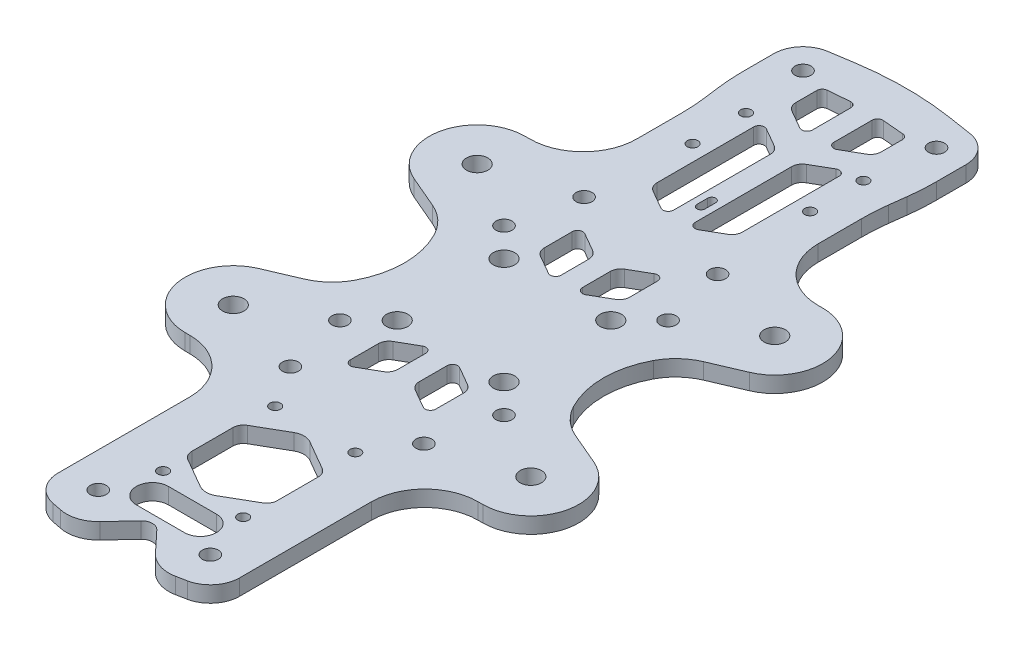
from build123d import *

# Parameters (mm, degrees)
SKETCH2_R           = 1
SKETCH2_R_2         = 1.5
SKETCH2_R_3         = 2
BOSS_EXTRUDE1_DEPTH = 3


with BuildPart() as part:
    # Sketch2 → Boss-Extrude1 (new body)
    with BuildSketch(Plane(origin=(0, 0, 0), x_dir=(1, 0, 0), z_dir=(0, 1, 0))):
        with BuildLine():
            Line((13.350883078, 73.933726478), (8.972891286, 74.619286567))
            ThreePointArc((8.972891286, 74.619286567), (-0.00011783, 75.317584084), (-8.973126945, 74.619286567))
            Line((-8.973126945, 74.619286567), (-13.350882829, 73.933763419))
            ThreePointArc((-13.350882829, 73.933763419), (-16.680339328, 72.07414751), (-17.999976849, 68.496158031))
            Line((-17.999976849, 68.496158031), (-17.99612821, 62.986537073))
            ThreePointArc((-17.99612821, 62.986537073), (-17.913159359, 60.376821385), (-17.66818978, 57.777304179))
            Line((-17.66818978, 57.777304179), (-17.287326461, 54.747455148))
            ThreePointArc((-17.287326461, 54.747455148), (-17.064020516, 52.368886066), (-16.990620696, 49.980985546))
            Line((-16.990620696, 49.980985546), (-16.994414065, 41.83534793))
            ThreePointArc((-16.994414065, 41.83534793), (-19.924991835, 34.767290769), (-26.994412981, 31.840004863))
            Line((-26.994412981, 31.840004863), (-27.864354565, 31.840004863))
            ThreePointArc((-27.864354565, 31.840004863), (-36.681216944, 24.646365231), (-31.403561403, 14.565102148))
            Line((-31.403561403, 14.565102148), (-25.40119143, 11.997866062))
            ThreePointArc((-25.40119143, 11.997866062), (-22.55844214, 10.158571988), (-20.492417257, 7.47607923))
            ThreePointArc((-20.492417257, 7.47607923), (-18.638379202, 0), (-20.492417257, -7.47607923))
            ThreePointArc((-20.492417257, -7.47607923), (-22.55844214, -10.158571988), (-25.40119143, -11.997866062))
            Line((-25.40119143, -11.997866062), (-31.403561403, -14.565102148))
            ThreePointArc((-31.403561403, -14.565102148), (-36.681216944, -24.646365231), (-27.864354565, -31.840004863))
            Line((-27.864354565, -31.840004863), (-26.999999944, -31.840004863))
            ThreePointArc((-26.999999944, -31.840004863), (-19.928932149, -34.768937035), (-16.999999944, -41.840004817))
            Line((-16.999999944, -41.840004817), (-16.999999829, -66.500000018))
            ThreePointArc((-16.999999829, -66.500000018), (-15.752129156, -69.988466165), (-12.574764869, -71.89396701))
            Line((-12.574764869, -71.89396701), (-10.754467086, -72.256667119))
            ThreePointArc((-10.754467086, -72.256667119), (-7.748879832, -72.085454613), (-5.204772908, -70.475986245))
            Line((-5.204772908, -70.475986245), (-1.459074237, -66.480574329))
            ThreePointArc((-1.459074237, -66.480574329), (1.71e-07, -65.848456587), (1.45907458, -66.480574329))
            Line((1.45907458, -66.480574329), (5.204773251, -70.475986245))
            ThreePointArc((5.204773251, -70.475986245), (7.748880174, -72.085454613), (10.754467429, -72.256667119))
            Line((10.754467429, -72.256667119), (12.574765212, -71.89396701))
            ThreePointArc((12.574765212, -71.89396701), (15.752129504, -69.988466158), (17.000000171, -66.5))
            Line((17.000000171, -66.5), (17.000000056, -41.84000491))
            ThreePointArc((17.000000056, -41.84000491), (19.928932228, -34.768937068), (27.000000056, -31.840004863))
            Line((27.000000056, -31.840004863), (27.864354565, -31.840004863))
            ThreePointArc((27.864354565, -31.840004863), (36.681216944, -24.646365231), (31.403561403, -14.565102148))
            Line((31.403561403, -14.565102148), (25.40119143, -11.997866062))
            ThreePointArc((25.40119143, -11.997866062), (22.55844214, -10.158571988), (20.492417257, -7.47607923))
            ThreePointArc((20.492417257, -7.47607923), (18.638379202, 0), (20.492417257, 7.47607923))
            ThreePointArc((20.492417257, 7.47607923), (22.55844214, 10.158571988), (25.40119143, 11.997866062))
            Line((25.40119143, 11.997866062), (31.403561403, 14.565102148))
            ThreePointArc((31.403561403, 14.565102148), (36.681216944, 24.646365231), (27.864354565, 31.840004863))
            Line((27.864354565, 31.840004863), (26.994413119, 31.840004863))
            ThreePointArc((26.994413119, 31.840004863), (19.924991932, 34.767290809), (16.994414203, 41.835348045))
            Line((16.994414203, 41.835348045), (16.990620673, 49.981415095))
            ThreePointArc((16.990620673, 49.981415095), (17.064035313, 52.369081916), (17.28732671, 54.747418207))
            Line((17.28732671, 54.747418207), (17.668190029, 57.777267238))
            ThreePointArc((17.668190029, 57.777267238), (17.913159608, 60.376784444), (17.996128459, 62.986500132))
            Line((17.996128459, 62.986500132), (17.999945801, 68.496188877))
            ThreePointArc((17.999945801, 68.496188877), (16.680306987, 72.074134906), (13.350883078, 73.933726478))
        make_face()
        with Locations(Location((-7.5, -35.348457, 0), (0, 0, 270))):
            Circle(SKETCH2_R, mode=Mode.SUBTRACT)
        with Locations(Location((-7.5, -56.348457, 0), (0, 0, 270))):
            Circle(SKETCH2_R, mode=Mode.SUBTRACT)
        with Locations(Location((7.5, -35.348457, 0), (0, 0, 270))):
            Circle(SKETCH2_R, mode=Mode.SUBTRACT)
        with Locations(Location((7.5, -56.348457, 0), (0, 0, 270))):
            Circle(SKETCH2_R, mode=Mode.SUBTRACT)
        with Locations(Location((-11.000072461, 46.317584084, 0), (0, 0, 270))):
            Circle(SKETCH2_R, mode=Mode.SUBTRACT)
        with Locations(Location((10.999927539, 46.317584084, 0), (0, 0, 270))):
            Circle(SKETCH2_R, mode=Mode.SUBTRACT)
        with Locations(Location((10.999927539, 56.317584084, 0), (0, 0, 90))):
            Circle(SKETCH2_R, mode=Mode.SUBTRACT)
        with Locations(Location((-11.000072461, 56.317584084, 0), (0, 0, 90))):
            Circle(SKETCH2_R, mode=Mode.SUBTRACT)
        with Locations(Location((10.500000167, -65.500000004, 0), (0, 0, 270))):
            Circle(SKETCH2_R_2, mode=Mode.SUBTRACT)
        with Locations(Location((-10.499999829, -65.5, 0), (0, 0, 270))):
            Circle(SKETCH2_R_2, mode=Mode.SUBTRACT)
        with Locations(Location((10.000016395, -10.000011804, 0), (0, 0, 270))):
            Circle(SKETCH2_R_3, mode=Mode.SUBTRACT)
        with Locations(Location((15.365, -15.365, 0), (0, 0, 270))):
            Circle(SKETCH2_R_2, mode=Mode.SUBTRACT)
        with Locations(Location((27.864354565, -22.840004863, 0), (0, 0, 270))):
            Circle(SKETCH2_R_3, mode=Mode.SUBTRACT)
        with Locations(Location((12.500000171, -27.5, 0), (0, 0, 270))):
            Circle(SKETCH2_R_2, mode=Mode.SUBTRACT)
        with Locations(Location((-10.000016395, -10.000011804, 0), (0, 0, 270))):
            Circle(SKETCH2_R_3, mode=Mode.SUBTRACT)
        with Locations(Location((-15.365, -15.365, 0), (0, 0, 270))):
            Circle(SKETCH2_R_2, mode=Mode.SUBTRACT)
        with Locations(Location((-12.499999829, -27.5, 0), (0, 0, 270))):
            Circle(SKETCH2_R_2, mode=Mode.SUBTRACT)
        with Locations(Location((-27.864354565, -22.840004863, 0), (0, 0, 270))):
            Circle(SKETCH2_R_3, mode=Mode.SUBTRACT)
        with Locations(Location((27.864354565, 22.840004863, 0), (0, 0, 270))):
            Circle(SKETCH2_R_3, mode=Mode.SUBTRACT)
        with Locations(Location((15.365, 15.365, 0), (0, 0, 270))):
            Circle(SKETCH2_R_2, mode=Mode.SUBTRACT)
        with Locations(Location((10.000016395, 10.000011804, 0), (0, 0, 270))):
            Circle(SKETCH2_R_3, mode=Mode.SUBTRACT)
        with Locations(Location((-10.000016395, 10.000011804, 0), (0, 0, 270))):
            Circle(SKETCH2_R_3, mode=Mode.SUBTRACT)
        with Locations(Location((-15.365, 15.365, 0), (0, 0, 270))):
            Circle(SKETCH2_R_2, mode=Mode.SUBTRACT)
        with Locations(Location((-27.864354565, 22.840004863, 0), (0, 0, 270))):
            Circle(SKETCH2_R_3, mode=Mode.SUBTRACT)
        with Locations(Location((-12.5, 27.5, 0), (0, 0, 270))):
            Circle(SKETCH2_R_2, mode=Mode.SUBTRACT)
        with Locations(Location((12.5, 27.5, 0), (0, 0, 270))):
            Circle(SKETCH2_R_2, mode=Mode.SUBTRACT)
        with Locations(Location((-12.499997086, 68.499999935, 0), (0, 0, 270))):
            Circle(SKETCH2_R_2, mode=Mode.SUBTRACT)
        with Locations(Location((12.500002914, 68.499999467, 0), (0, 0, 270))):
            Circle(SKETCH2_R_2, mode=Mode.SUBTRACT)
        with BuildLine():
            Line((0.749999899, 38.901923806), (0.749999899, 36.901923806))
            ThreePointArc((0.749999899, 36.901923806), (-1.01e-07, 36.151923806), (-0.750000101, 36.901923806))
            Line((-0.750000101, 36.901923806), (-0.750000101, 38.901923806))
            ThreePointArc((-0.750000101, 38.901923806), (-1.01e-07, 39.651923806), (0.749999899, 38.901923806))
        make_face(mode=Mode.SUBTRACT)
        with BuildLine():
            Line((-4.5, -58.348456587), (4.5, -58.348456587))
            ThreePointArc((4.5, -58.348456587), (7.5, -61.348456587), (4.5, -64.348456587))
            Line((4.5, -64.348456587), (-4.5, -64.348456587))
            ThreePointArc((-4.5, -64.348456587), (-7.5, -61.348456587), (-4.5, -58.348456587))
        make_face(mode=Mode.SUBTRACT)
        with BuildLine():
            Line((7, -41.041451884), (1.5, -37.866025404))
            ThreePointArc((1.5, -37.866025404), (0, -37.464101615), (-1.5, -37.866025404))
            Line((-1.5, -37.866025404), (-7, -41.041451884))
            ThreePointArc((-7, -41.041451884), (-7.732050808, -41.773502692), (-8, -42.773502692))
            Line((-8, -42.773502692), (-8, -50.464101615))
            ThreePointArc((-8, -50.464101615), (-7.732050808, -51.464101615), (-7, -52.196152423))
            Line((-7, -52.196152423), (-1.5, -55.371578903))
            ThreePointArc((-1.5, -55.371578903), (0, -55.773502692), (1.5, -55.371578903))
            Line((1.5, -55.371578903), (7, -52.196152423))
            ThreePointArc((7, -52.196152423), (7.732050808, -51.464101615), (8, -50.464101615))
            Line((8, -50.464101615), (8, -42.773502692))
            ThreePointArc((8, -42.773502692), (7.732050808, -41.773502692), (7, -41.041451884))
        make_face(mode=Mode.SUBTRACT)
        with BuildLine():
            Line((2.999999875, -19.613248636), (6.499999844, -21.633974619))
            ThreePointArc((6.499999844, -21.633974619), (7.500547408, -21.634424586), (8.001989831, -20.768600628))
            Line((8.001989831, -20.768600628), (8.011329949, -15.576420031))
            ThreePointArc((8.011329949, -15.576420031), (7.74515233, -14.5758914), (7.014351026, -13.842517334))
            Line((7.014351026, -13.842517334), (3.517878924, -11.815693189))
            ThreePointArc((3.517878924, -11.815693189), (2.517469418, -11.814186451), (2.016370335, -12.680050851))
            Line((2.016370335, -12.680050851), (2.012220809, -17.900793835))
            ThreePointArc((2.012220809, -17.900793835), (2.276502543, -18.889463725), (2.999999875, -19.613248636))
        make_face(mode=Mode.SUBTRACT)
        with BuildLine():
            Line((-6.500000155, -21.633974611), (-3.00000291, -19.61325026))
            ThreePointArc((-3.00000291, -19.61325026), (-2.26349058, -18.877378982), (-1.992712343, -17.872075))
            Line((-1.992712343, -17.872075), (-1.983656412, -12.672108118))
            ThreePointArc((-1.983656412, -12.672108118), (-2.482135392, -11.805233368), (-3.482110435, -11.803490607))
            Line((-3.482110435, -11.803490607), (-6.985627702, -13.818112198))
            ThreePointArc((-6.985627702, -13.818112198), (-7.718918203, -14.548849716), (-7.988598804, -15.548331908))
            Line((-7.988598804, -15.548331908), (-7.997709151, -20.767528161))
            ThreePointArc((-7.997709151, -20.767528161), (-7.499228332, -21.633538561), (-6.500000155, -21.633974611))
        make_face(mode=Mode.SUBTRACT)
        with BuildLine():
            Line((3.517878923, 11.815693192), (7.014351026, 13.842517334))
            ThreePointArc((7.014351026, 13.842517334), (7.74515233, 14.5758914), (8.011329949, 15.576420031))
            Line((8.011329949, 15.576420031), (8.001989831, 20.768600628))
            ThreePointArc((8.001989831, 20.768600628), (7.500547408, 21.634424586), (6.499999844, 21.633974619))
            Line((6.499999844, 21.633974619), (2.999999852, 19.613248675))
            ThreePointArc((2.999999852, 19.613248675), (2.276502504, 18.889463747), (2.012220763, 17.900793835))
            Line((2.012220763, 17.900793835), (2.016370338, 12.680050851))
            ThreePointArc((2.016370338, 12.680050851), (2.517469419, 11.814186454), (3.517878923, 11.815693192))
        make_face(mode=Mode.SUBTRACT)
        with BuildLine():
            Line((-3.00000291, 19.61325026), (-6.500000155, 21.633974611))
            ThreePointArc((-6.500000155, 21.633974611), (-7.499228332, 21.633538561), (-7.997709151, 20.767528161))
            Line((-7.997709151, 20.767528161), (-7.988598804, 15.548331908))
            ThreePointArc((-7.988598804, 15.548331908), (-7.718918202, 14.548849716), (-6.985627702, 13.818112198))
            Line((-6.985627702, 13.818112198), (-3.482110435, 11.803490607))
            ThreePointArc((-3.482110435, 11.803490607), (-2.482135392, 11.805233368), (-1.983656412, 12.672108118))
            Line((-1.983656412, 12.672108118), (-1.992712343, 17.872075))
            ThreePointArc((-1.992712343, 17.872075), (-2.26349058, 18.877378982), (-3.00000291, 19.61325026))
        make_face(mode=Mode.SUBTRACT)
        with BuildLine():
            Line((3.499999899, 32.901923807), (6.999999893, 34.922649745))
            ThreePointArc((6.999999893, 34.922649745), (7.732050697, 35.654700549), (7.999999886, 36.654700545))
            Line((7.999999886, 36.654700545), (7.999999845, 54.767949218))
            ThreePointArc((7.999999845, 54.767949218), (7.499999844, 55.63397462), (6.499999845, 55.633974619))
            Line((6.499999845, 55.633974619), (2.999999852, 53.61324868))
            ThreePointArc((2.999999852, 53.61324868), (2.267949047, 52.881197873), (1.999999857, 51.881197876))
            Line((1.999999857, 51.881197876), (1.999999896, 33.767949211))
            ThreePointArc((1.999999896, 33.767949211), (2.499999898, 32.901923807), (3.499999899, 32.901923807))
        make_face(mode=Mode.SUBTRACT)
        with BuildLine():
            Line((-7.000000107, 34.922649752), (-3.500000101, 32.901923805))
            ThreePointArc((-3.500000101, 32.901923805), (-2.500023539, 32.901923382), (-2.00003416, 33.767927854))
            Line((-2.00003416, 33.767927854), (-2.000000143, 51.881191279))
            ThreePointArc((-2.000000143, 51.881191279), (-2.267949232, 52.881195963), (-3.00000291, 53.61325026))
            Line((-3.00000291, 53.61325026), (-6.500000155, 55.63397461))
            ThreePointArc((-6.500000155, 55.63397461), (-7.500001159, 55.633974031), (-8.000000155, 54.767946888))
            Line((-8.000000155, 54.767946888), (-7.999953523, 36.654615238))
            ThreePointArc((-7.999953523, 36.654615238), (-7.732015654, 35.654664451), (-7.000000107, 34.922649752))
        make_face(mode=Mode.SUBTRACT)
        with BuildLine():
            Line((3.499999898, 58.901923808), (6.999999892, 60.922649745))
            ThreePointArc((6.999999892, 60.922649745), (7.732050701, 61.654700553), (7.999999893, 62.654700553))
            Line((7.999999893, 62.654700553), (7.999999882, 66.594635247))
            ThreePointArc((7.999999882, 66.594635247), (7.737277218, 67.270225453), (7.087155625, 67.590829944))
            Line((7.087155625, 67.590829944), (3.087155624, 67.940784602))
            ThreePointArc((3.087155624, 67.940784602), (2.324409672, 67.68186724), (1.99999988, 66.944589901))
            Line((1.99999988, 66.944589901), (1.999999898, 59.76794921))
            ThreePointArc((1.999999898, 59.76794921), (2.499999899, 58.901923808), (3.499999898, 58.901923808))
        make_face(mode=Mode.SUBTRACT)
        with BuildLine():
            Line((-7.000000108, 60.922649753), (-3.500000102, 58.901923807))
            ThreePointArc((-3.500000102, 58.901923807), (-2.500000101, 58.901923807), (-2.000000102, 59.767949212))
            Line((-2.000000102, 59.767949212), (-2.000000119, 66.9445899))
            ThreePointArc((-2.000000119, 66.9445899), (-2.324409912, 67.681867235), (-3.087155862, 67.940784596))
            Line((-3.087155862, 67.940784596), (-7.087155862, 67.590829942))
            ThreePointArc((-7.087155862, 67.590829942), (-7.737277457, 67.27022545), (-8.00000012, 66.594635241))
            Line((-8.00000012, 66.594635241), (-8.000000107, 62.654700557))
            ThreePointArc((-8.000000107, 62.654700557), (-7.732050914, 61.654700559), (-7.000000108, 60.922649753))
        make_face(mode=Mode.SUBTRACT)
    extrude(amount=BOSS_EXTRUDE1_DEPTH)


solid = part.part
